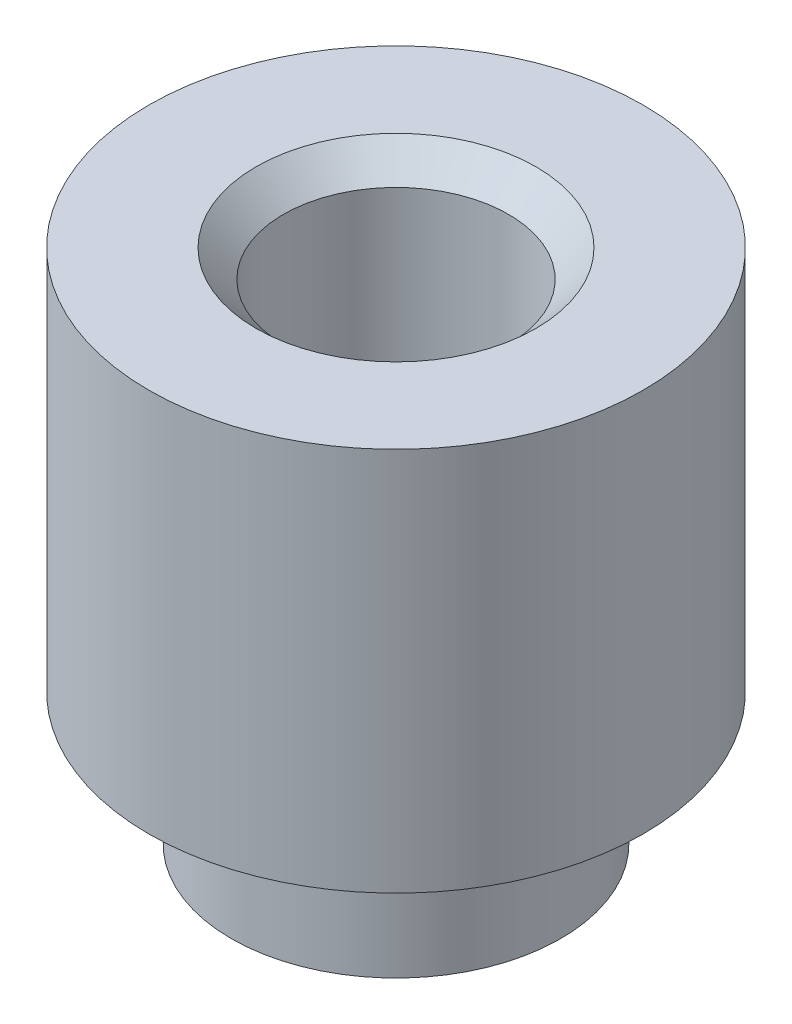
from build123d import *

# Parameters (mm, degrees)
SKETCH_1_R                     = 1.5
EXTRUDE_1_DEPTH                = 1.2
SKETCH_2_R                     = 2.25
EXTRUDE_2_DEPTH                = 3.5
HOLE_WIZARD_M2_5_1_D           = 2.05
HOLE_WIZARD_M2_5_1_CSINK_D     = 2.55
HOLE_WIZARD_M2_5_1_CSINK_ANGLE = 90


with BuildPart() as part:
    # 草图1 → 凸台-拉伸1 (new body)
    with BuildSketch(Plane(origin=(0, 0, 0), x_dir=(1, 0, 0), z_dir=(0, 1, 0))):
        with Locations(Location((0, 0, 0), (0, 0, 270))):
            Circle(SKETCH_1_R)
    extrude(amount=EXTRUDE_1_DEPTH)

    # 草图2 → 凸台-拉伸2 (add)
    with BuildSketch(Plane(origin=(0, 1.2, 0), x_dir=(1, 0, 0), z_dir=(0, 1, 0))):
        with Locations(Location((0, 0, 0), (0, 0, 270))):
            Circle(SKETCH_2_R)
    extrude(amount=EXTRUDE_2_DEPTH)

    # M2.5 螺纹孔1 (through all)
    with Locations(Plane(origin=(0, 4.7, 0), x_dir=(1, 0, 0), z_dir=(0, 1, 0))):
        with Locations((0, 0)):
            CounterSinkHole(HOLE_WIZARD_M2_5_1_D / 2, HOLE_WIZARD_M2_5_1_CSINK_D / 2, counter_sink_angle=HOLE_WIZARD_M2_5_1_CSINK_ANGLE)


solid = part.part
